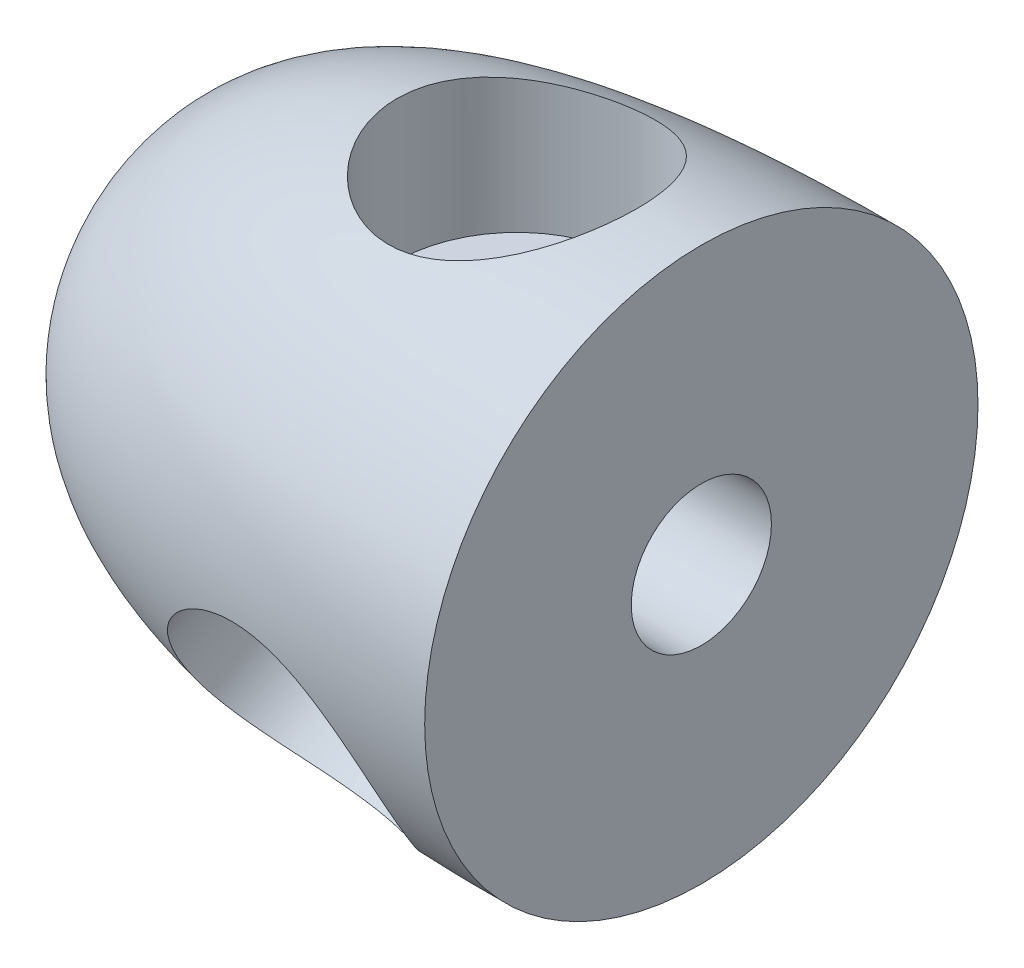
from build123d import *

# Parameters (mm, degrees)
SKETCH2_R          = 8.255
CUT_EXTRUDE1_DEPTH = 11.43
CIRPATTERN3_COUNT  = 3
SKETCH3_R          = 4.826
CUT_EXTRUDE2_DEPTH = 12.7


with BuildPart() as part:
    # Sketch1 → Revolve1 (revolve)
    with BuildSketch(Plane.XY):
        with BuildLine():
            Line((0, 0), (0, 19.05))
            add(Edge.make_bspline(
                [(-38.1, 0), (-38.1, 14.199031657), (-25.444195721, 19.05), (0, 19.05)],
                knots=[0, 0, 0, 0, 1, 1, 1, 1], degree=3))
            Line((-38.1, 0), (0, 0))
        make_face()
    revolve(axis=Axis((-38.1, 0, 0), (1, 0, 0)))

    # Sketch2 → Cut-Extrude1 (cut)
    with BuildSketch(Plane(origin=(0, 19.05, 0), x_dir=(1, 0, 0), z_dir=(0, 1, 0))):
        with Locations(Location((-12.7, 0, 0), (0, 0, 270))):
            Circle(SKETCH2_R)
    cut_extrude1 = extrude(amount=-CUT_EXTRUDE1_DEPTH, mode=Mode.SUBTRACT)

    # CirPattern3: Cut-Extrude1 ×3 about axis
    cirpattern3_axis = Axis((0, 0, 0), (1, 0, 0))
    for i in range(1, CIRPATTERN3_COUNT):
        add(cut_extrude1.rotate(cirpattern3_axis, i * 360 / CIRPATTERN3_COUNT), mode=Mode.SUBTRACT)

    # Sketch3 → Cut-Extrude2 (cut)
    with BuildSketch(Plane(origin=(0, 0, 0), x_dir=(0, 0, -1), z_dir=(1, 0, 0))):
        Circle(SKETCH3_R)
    extrude(amount=-CUT_EXTRUDE2_DEPTH, mode=Mode.SUBTRACT)


solid = part.part
